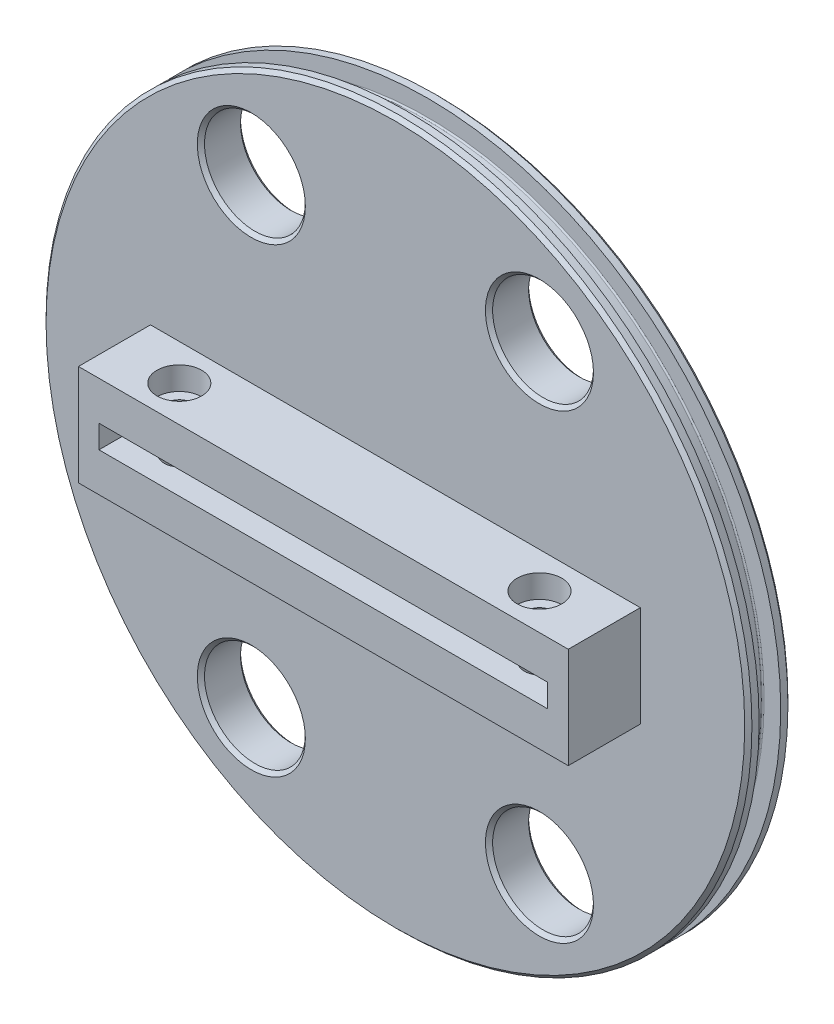
from build123d import *

# Parameters (mm, degrees)
SKETCH1_R                               = 49
DISC_PLATE_DEPTH                        = 6
SKETCH2_W                               = 68
SKETCH2_H                               = 14
BOSS_DEPTH                              = 10
SKETCH3_W                               = 62.3
SKETCH3_H                               = 3.2
SPINE_SLOT_DEPTH                        = 10
SKETCH4_W                               = 3
SKETCH4_H                               = 5.5
FILLET1_R                               = 0.2
CBORE_FOR_M5_HEX_HEAD_BOLT1_D           = 3.4
CBORE_FOR_M5_HEX_HEAD_BOLT1_DEPTH       = 5.4
CBORE_FOR_M5_HEX_HEAD_BOLT1_CBORE_D     = 6.2
CBORE_FOR_M5_HEX_HEAD_BOLT1_CBORE_DEPTH = 3.2
CBORE_FOR_M5_HEX_HEAD_BOLT1_TIP         = 1.021463052
SKETCH9_R                               = 2.1
INSERT_HOLES_DEPTH                      = 6.5
SKETCH10_R                              = 7
CABLE_HOLES_DEPTH                       = 72.119617547
CHAMFER1_SIZE                           = 0.5


with BuildPart() as part:
    # Sketch1 → Disc_Plate (new body)
    with BuildSketch(Plane.XY):
        Circle(SKETCH1_R)
    extrude(amount=DISC_PLATE_DEPTH)

    # Sketch2 → Boss (add)
    with BuildSketch(Plane.XY.offset(6)):
        Rectangle(SKETCH2_W, SKETCH2_H)
    extrude(amount=BOSS_DEPTH)

    # Sketch3 → Spine Slot (cut)
    with BuildSketch(Plane.XY.offset(16)):
        Rectangle(SKETCH3_W, SKETCH3_H)
    extrude(amount=-SPINE_SLOT_DEPTH, mode=Mode.SUBTRACT)

    # Sketch4 → Friction_Groove (revolve, cut)
    with BuildSketch(Plane(origin=(0, 0, 0), x_dir=(0, 0, -1), z_dir=(1, 0, 0))):
        with Locations((-3, 49.25)):
            Rectangle(SKETCH4_W, SKETCH4_H)
    revolve(axis=Axis((0, 0, 6), (0, 0, -1)), mode=Mode.SUBTRACT)

    # Fillet1
    fillet1_edges = [part.edges().sort_by_distance(p)[0] for p in [
        (0, -46.5, 1.5),
        (0, -46.5, 4.5),
    ]]
    fillet(fillet1_edges, radius=FILLET1_R)

    # CBORE for M5 Hex Head Bolt1
    with Locations(Plane(origin=(0, 7, 0), x_dir=(1, 0, 0), z_dir=(0, 1, 0))):
        with Locations((-25, -11), (25, -11), (11.381423857, 19.171145686)):
            CounterBoreHole(CBORE_FOR_M5_HEX_HEAD_BOLT1_D / 2, CBORE_FOR_M5_HEX_HEAD_BOLT1_CBORE_D / 2, CBORE_FOR_M5_HEX_HEAD_BOLT1_CBORE_DEPTH, depth=CBORE_FOR_M5_HEX_HEAD_BOLT1_DEPTH)
            with Locations((0, 0, -(CBORE_FOR_M5_HEX_HEAD_BOLT1_DEPTH + CBORE_FOR_M5_HEX_HEAD_BOLT1_TIP / 2))):  # 118° drill point
                Cone(0, CBORE_FOR_M5_HEX_HEAD_BOLT1_D / 2, CBORE_FOR_M5_HEX_HEAD_BOLT1_TIP, mode=Mode.SUBTRACT)

    # Sketch9 → Insert_Holes (cut)
    with BuildSketch(Plane(origin=(0, -1.6, 0), x_dir=(1, 0, 0), z_dir=(0, 1, 0))):
        with Locations((-25, -11)):
            Circle(SKETCH9_R)
        with Locations((25, -11)):
            Circle(SKETCH9_R)
    extrude(amount=-INSERT_HOLES_DEPTH, mode=Mode.SUBTRACT)

    # Sketch10 → Cable_Holes (cut, through all)
    with BuildSketch(Plane.XY):
        with Locations((20, 32)):
            Circle(SKETCH10_R)
        with Locations((20, -32)):
            Circle(SKETCH10_R)
        with Locations((-20, -32)):
            Circle(SKETCH10_R)
        with Locations((-20, 32)):
            Circle(SKETCH10_R)
    extrude(amount=CABLE_HOLES_DEPTH, mode=Mode.SUBTRACT)

    # Chamfer1
    chamfer1_edges = [part.edges().sort_by_distance(p)[0] for p in [
        (13, -32, 6),
        (13, -32, 0),
        (-27, -32, 0),
        (-27, -32, 6),
        (-27, 32, 0),
        (-27, 32, 6),
        (13, 32, 0),
        (13, 32, 6),
        (-49, 0, 0),
        (-49, 0, 6),
    ]]
    chamfer(chamfer1_edges, length=CHAMFER1_SIZE)


solid = part.part
